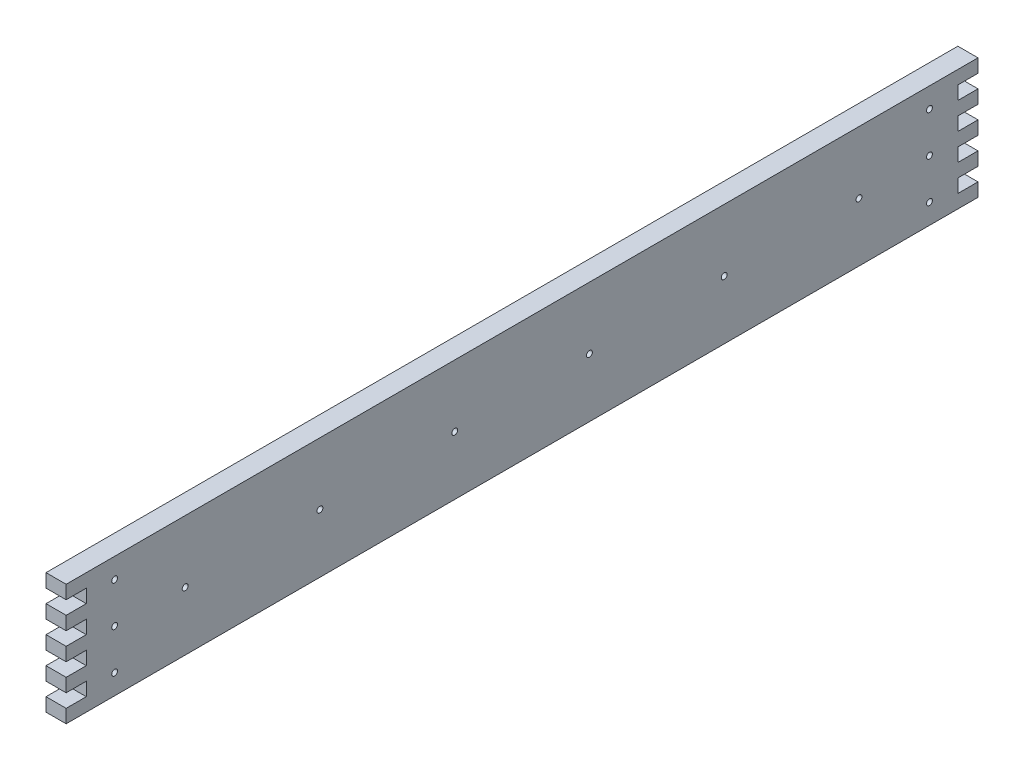
from build123d import *

# Parameters (mm, degrees)
BOSS_EXTRUDE1_DEPTH             = 19.05
F_7_32_0_21875_DIAMETER_HOLE2_D = 5.55625


with BuildPart() as part:
    # Sketch1 → Boss-Extrude1 (new body)
    with BuildSketch(Plane(origin=(0, 0, 0), x_dir=(0, 0, -1), z_dir=(1, 0, 0))):
        Polygon((0, 0), (862.33, 0), (862.33, 12.7), (843.28, 12.7), (843.28, 25.4), (862.33, 25.4), (862.33, 38.1), (843.28, 38.1), (843.28, 50.8), (862.33, 50.8), (862.33, 63.5), (843.28, 63.5), (843.28, 76.2), (862.33, 76.2), (862.33, 88.9), (843.28, 88.9), (843.28, 101.6), (862.33, 101.6), (862.33, 114.3), (0, 114.3), (0, 101.6), (19.05, 101.6), (19.05, 88.9), (0, 88.9), (0, 76.2), (19.05, 76.2), (19.05, 63.5), (0, 63.5), (0, 50.8), (19.05, 50.8), (19.05, 38.1), (0, 38.1), (0, 25.4), (19.05, 25.4), (19.05, 12.7), (0, 12.7), align=None)
    extrude(amount=BOSS_EXTRUDE1_DEPTH)

    # 7/32 (0.21875) Diameter Hole2 (through all)
    with Locations(Plane(origin=(19.05, 0, 0), x_dir=(0, 0, -1), z_dir=(1, 0, 0))):
        with Locations((816.4449, 57.15), (112.5601, 55.499), (240.00206, 55.499), (367.44402, 55.499), (494.88598, 55.499), (622.32794, 55.499), (749.7699, 55.499), (816.4449, 95.25), (816.4449, 19.05), (45.8851, 95.25), (45.8851, 19.05), (45.8851, 57.15)):
            Hole(F_7_32_0_21875_DIAMETER_HOLE2_D / 2)


solid = part.part
